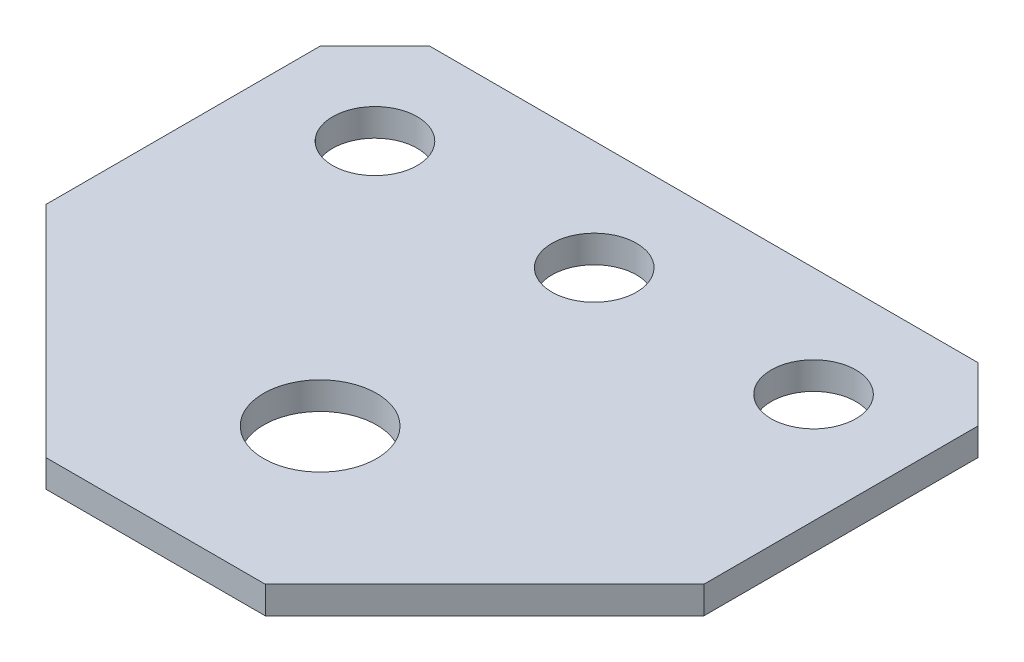
from build123d import *

# Parameters (mm, degrees)
SKETCH1_W               = 76.2
SKETCH1_H               = 63.5
BOSS_EXTRUDE1_DEPTH     = 1.5875
F_3_8_CLEARANCE_HOLE1_D = 9.8044
F_1_2_CLEARANCE_HOLE1_D = 13.09624
CHAMFER1_SIZE           = 25.4
CHAMFER2_SIZE           = 6.35


with BuildPart() as part:
    # Sketch1 → Boss-Extrude1 (new, symmetric)
    with BuildSketch(Plane(origin=(0, 0, 0), x_dir=(1, 0, 0), z_dir=(0, 1, 0))):
        Rectangle(SKETCH1_W, SKETCH1_H)
    extrude(amount=BOSS_EXTRUDE1_DEPTH, both=True)

    # 3/8 Clearance Hole1 (through all)
    with Locations(Plane(origin=(0, 1.5875, 0), x_dir=(1, 0, 0), z_dir=(0, 1, 0))):
        with Locations((0, 19.05), (25.4, 19.05), (-25.4, 19.05)):
            Hole(F_3_8_CLEARANCE_HOLE1_D / 2)

    # 1/2 Clearance Hole1 (through all)
    with Locations(Plane(origin=(0, 1.5875, 0), x_dir=(1, 0, 0), z_dir=(0, 1, 0))):
        with Locations((0, -12.7)):
            Hole(F_1_2_CLEARANCE_HOLE1_D / 2)

    # Chamfer1
    chamfer1_edges = [part.edges().sort_by_distance(p)[0] for p in [
        (38.1, 0, 31.75),
        (-38.1, 0, 31.75),
    ]]
    chamfer(chamfer1_edges, length=CHAMFER1_SIZE)

    # Chamfer2
    chamfer2_edges = [part.edges().sort_by_distance(p)[0] for p in [
        (-38.1, 0, -31.75),
        (38.1, 0, -31.75),
    ]]
    chamfer(chamfer2_edges, length=CHAMFER2_SIZE)


solid = part.part
